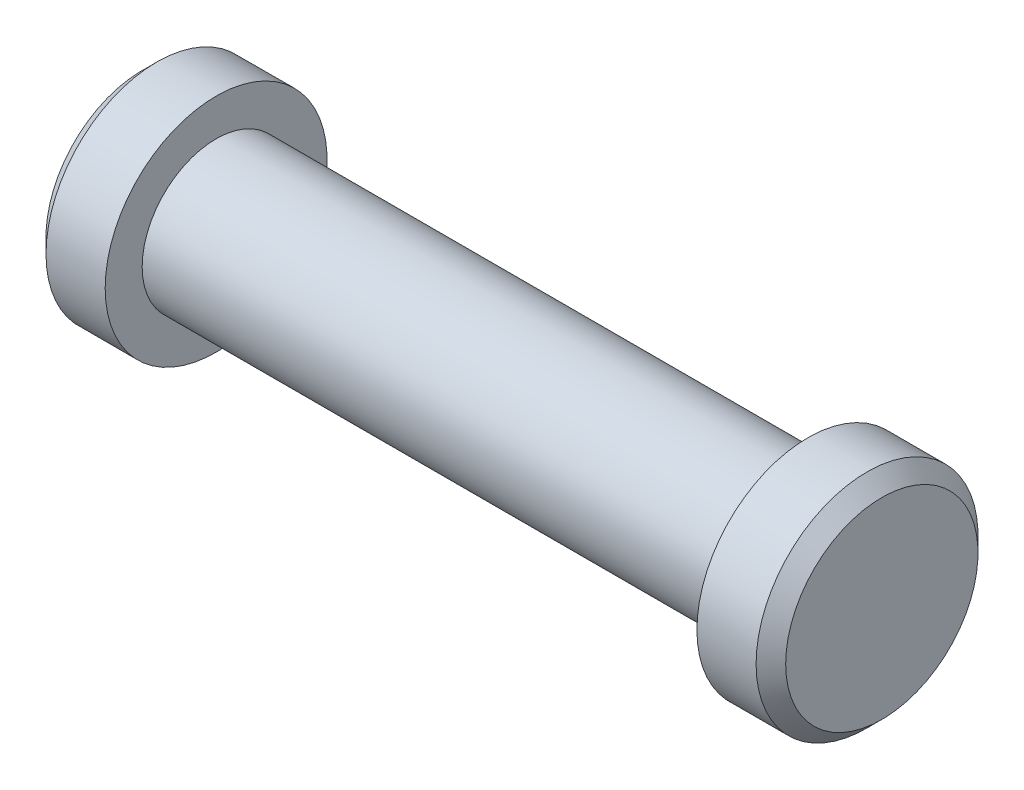
from build123d import *

# Parameters (mm, degrees)
CHAMFER1_SIZE = 0.254
SCALE1_SCALE  = 1.5


with BuildPart() as part:
    # Sketch1 → Revolve1 (revolve)
    with BuildSketch(Plane.XY, mode=Mode.PRIVATE) as revolve1_sk:
        Polygon((-6.35, 0), (-6.35, 1.905), (-5.08, 1.905), (-5.08, 1.27), (5.08, 1.27), (5.08, 1.905), (6.35, 1.905), (6.35, 0), align=None)
    revolve(revolve1_sk.sketch.rotate(Axis((-6.35, 0, 0), (1, 0, 0)), 90), axis=Axis((-6.35, 0, 0), (1, 0, 0)))

    # Chamfer1
    chamfer1_edges = [part.edges().sort_by_distance(p)[0] for p in [
        (6.35, 0, -1.905),
        (-6.35, 0, -1.905),
    ]]
    chamfer(chamfer1_edges, length=CHAMFER1_SIZE)


with BuildPart() as part_1:
    # Scale1: scaled about (0, 0, 0)
    add(part.part.scale(SCALE1_SCALE))


solid = part_1.part
